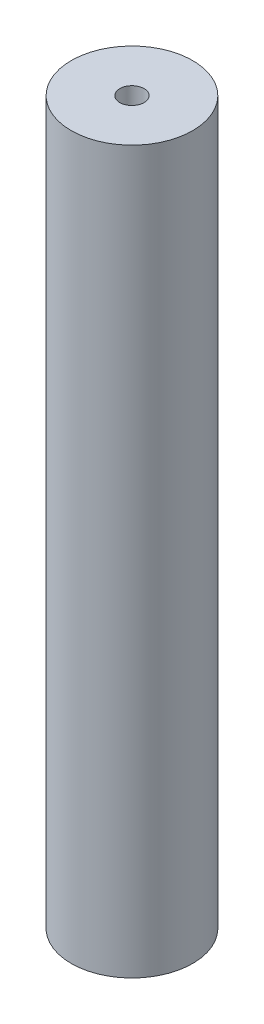
from build123d import *

# Parameters (mm, degrees)
SKETCH1_R           = 8
BOSS_EXTRUDE1_DEPTH = 95
SKETCH2_R           = 1.6
CUT_EXTRUDE1_DEPTH  = 95


with BuildPart() as part:
    # Sketch1 → Boss-Extrude1 (new body)
    with BuildSketch(Plane(origin=(0, 0, 0), x_dir=(1, 0, 0), z_dir=(0, 1, 0))):
        with Locations(Location((0, 0, 0), (0, 0, 270))):
            Circle(SKETCH1_R)
    extrude(amount=BOSS_EXTRUDE1_DEPTH)

    # Sketch2 → Cut-Extrude1 (cut)
    with BuildSketch(Plane.XZ):
        with Locations(Location((0, 0, 0), (0, 0, 270))):
            Circle(SKETCH2_R)
    extrude(amount=-CUT_EXTRUDE1_DEPTH, mode=Mode.SUBTRACT)


solid = part.part
